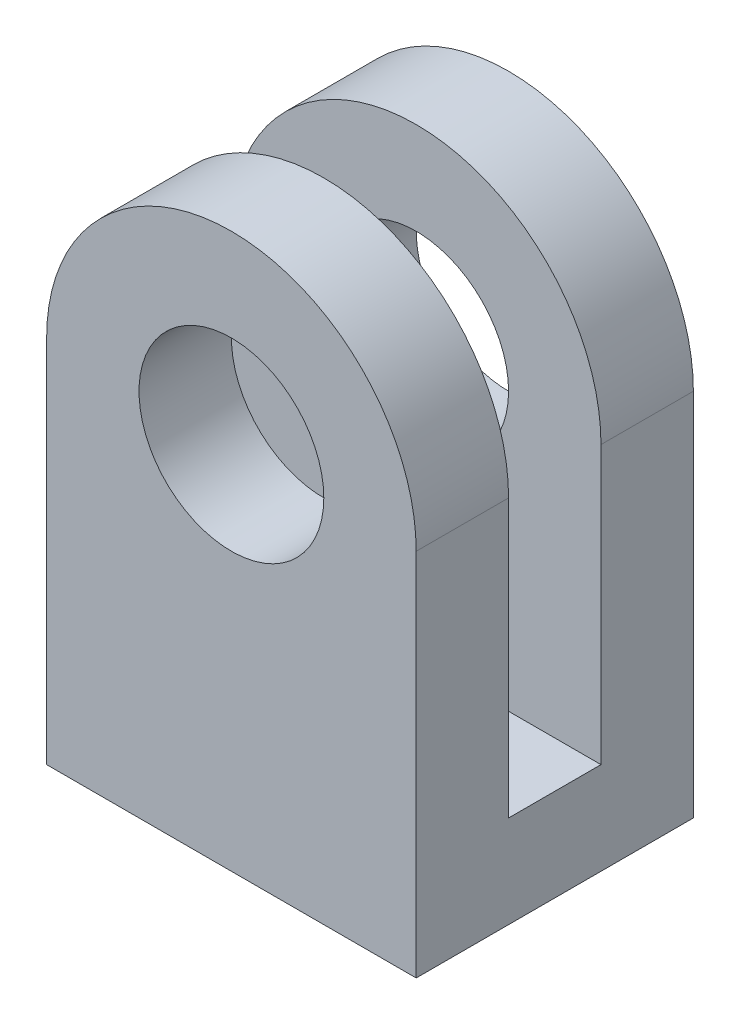
from build123d import *

# Parameters (mm, degrees)
SKETCH1_W           = 40
SKETCH1_H           = 10
BOSS_EXTRUDE1_DEPTH = 15
SKETCH1_3_R         = 10
BOSS_EXTRUDE2_DEPTH = 10


with BuildPart() as part:
    # Sketch1 → Boss-Extrude1 (new body)
    with BuildSketch(Plane.XY):
        with Locations((20, 5)):
            Rectangle(SKETCH1_W, SKETCH1_H)
    boss_extrude1 = extrude(amount=BOSS_EXTRUDE1_DEPTH)

    # Sketch1<3> → Boss-Extrude2 (add)
    with BuildSketch(Plane.XY):
        with BuildLine():
            Line((0, 40), (0, 10))
            Line((0, 10), (40, 10))
            Line((40, 10), (40, 40))
            ThreePointArc((40, 40), (20, 60), (0, 40))
        make_face()
        with Locations((20, 40)):
            Circle(SKETCH1_3_R, mode=Mode.SUBTRACT)
    boss_extrude2 = extrude(amount=BOSS_EXTRUDE2_DEPTH)

    # Mirror1: Boss-Extrude1, Boss-Extrude2 across plane
    add(boss_extrude1.mirror(Plane.XY.offset(15)))
    add(boss_extrude2.mirror(Plane.XY.offset(15)))


solid = part.part
